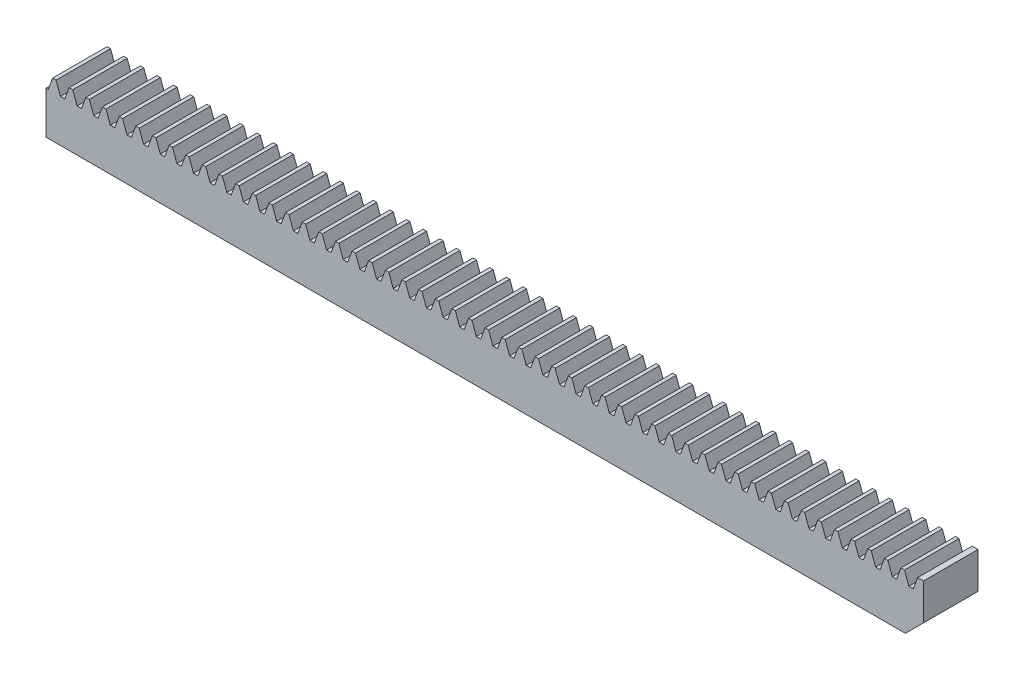
from build123d import *

# Parameters (mm, degrees)
SKETCH1_W                    = 290
SKETCH1_H                    = 18
BOSS_EXTRUDE1_DEPTH          = 9
CHAMFER1_SIZE                = 6
CUT_EXTRUDE1_DEPTH           = 147.389890361
LPATTERN1_COUNT              = 53
LPATTERN1_PITCH              = 5.4978
F_6_0_6_DIAMETER_HOLE1_D     = 6
F_6_0_6_DIAMETER_HOLE1_DEPTH = 14
F_6_0_6_DIAMETER_HOLE1_TIP   = 1.802581857


with BuildPart() as part:
    # Sketch1 → Boss-Extrude1 (new, symmetric)
    with BuildSketch(Plane.XY):
        Rectangle(SKETCH1_W, SKETCH1_H)
    extrude(amount=BOSS_EXTRUDE1_DEPTH, both=True)

    # Chamfer1
    chamfer1_edges = [part.edges().sort_by_distance(p)[0] for p in [
        (145, -9, 0),
    ]]
    chamfer(chamfer1_edges, length=CHAMFER1_SIZE)

    # Sketch2 → Cut-Extrude1 (cut, through all)
    with BuildSketch(Plane.XY.offset(9)):
        Polygon((-142.82805209, 9), (-147.17194791, 9), (-145.737905187, 5.06), (-144.262094813, 5.06), align=None)
    cut_extrude1 = extrude(amount=-CUT_EXTRUDE1_DEPTH, mode=Mode.SUBTRACT)

    # LPattern1: Cut-Extrude1 ×53
    with Locations(*[(i * LPATTERN1_PITCH, 0, 0) for i in range(1, LPATTERN1_COUNT)]):
        add(cut_extrude1, mode=Mode.SUBTRACT)

    # Ø6.0 (6) Diameter Hole1
    with Locations(Plane.ZY.offset(145)):
        with Locations((0, -1.97)):
            Hole(F_6_0_6_DIAMETER_HOLE1_D / 2, depth=F_6_0_6_DIAMETER_HOLE1_DEPTH)
            with Locations((0, 0, -(F_6_0_6_DIAMETER_HOLE1_DEPTH + F_6_0_6_DIAMETER_HOLE1_TIP / 2))):  # 118° drill point
                Cone(0, F_6_0_6_DIAMETER_HOLE1_D / 2, F_6_0_6_DIAMETER_HOLE1_TIP, mode=Mode.SUBTRACT)


solid = part.part
